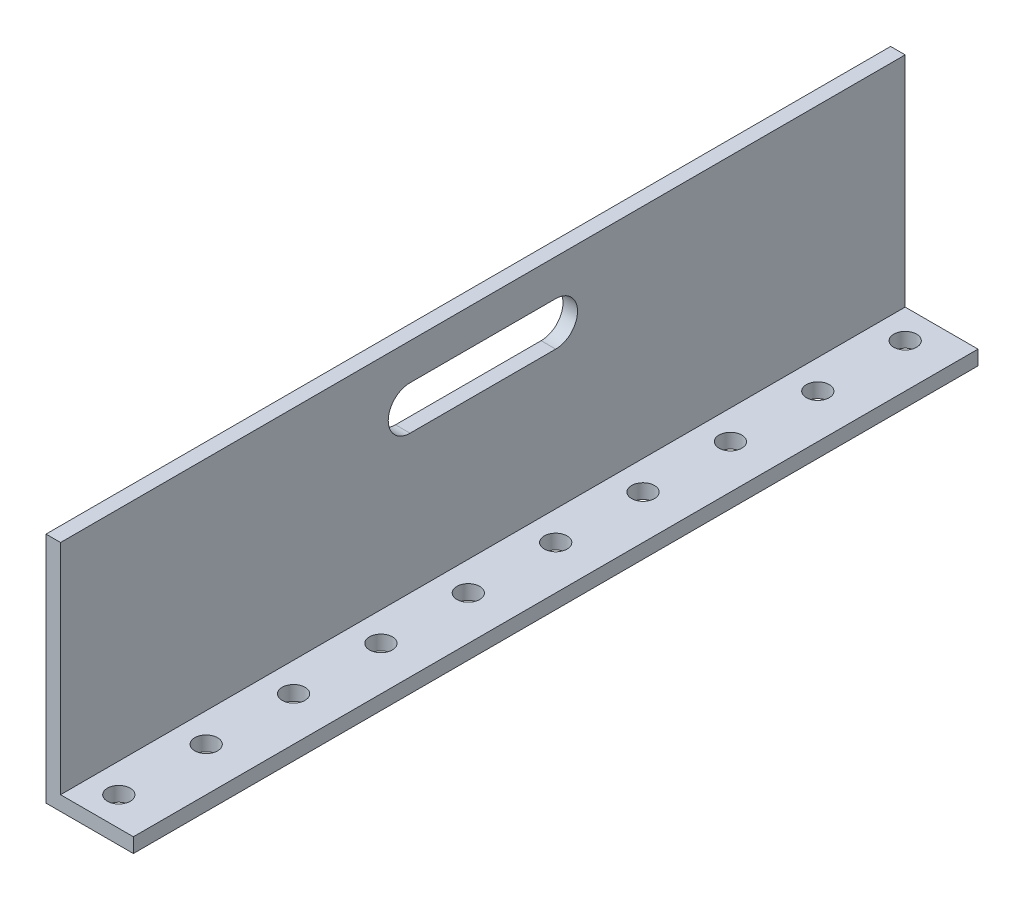
from build123d import *

# Parameters (mm, degrees)
SKETCH1_W           = 3.175
SKETCH1_H           = 47.625
SKETCH1_H_2         = 3.175
SKETCH1_W_2         = 15.875
BOSS_EXTRUDE1_DEPTH = 184.15
SKETCH2_R           = 2.4892
CUT_EXTRUDE1_DEPTH  = 184.15
CUT_EXTRUDE2_DEPTH  = 165.1


with BuildPart() as part:
    # Sketch1 → Boss-Extrude1 (new body)
    with BuildSketch(Plane.XY):
        with Locations((1.5875, 26.9875)):
            Rectangle(SKETCH1_W, SKETCH1_H)
        with Locations((1.5875, 1.5875)):
            Rectangle(SKETCH1_W, SKETCH1_H_2)
        with Locations((11.1125, 1.5875)):
            Rectangle(SKETCH1_W_2, SKETCH1_H_2)
    extrude(amount=BOSS_EXTRUDE1_DEPTH)

    # Sketch2 → Cut-Extrude1 (cut)
    with BuildSketch(Plane(origin=(0, 3.175, 0), x_dir=(1, 0, 0), z_dir=(0, 1, 0))):
        with Locations(Location((9.525, -6.35, 0), (0, 0, 270))):
            Circle(SKETCH2_R)
        with Locations(Location((9.525, -25.4, 0), (0, 0, 270))):
            Circle(SKETCH2_R)
        with Locations(Location((9.525, -44.45, 0), (0, 0, 270))):
            Circle(SKETCH2_R)
        with Locations(Location((9.525, -63.5, 0), (0, 0, 270))):
            Circle(SKETCH2_R)
        with Locations(Location((9.525, -82.55, 0), (0, 0, 270))):
            Circle(SKETCH2_R)
        with Locations(Location((9.525, -101.6, 0), (0, 0, 270))):
            Circle(SKETCH2_R)
        with Locations(Location((9.525, -120.65, 0), (0, 0, 270))):
            Circle(SKETCH2_R)
        with Locations(Location((9.525, -139.7, 0), (0, 0, 270))):
            Circle(SKETCH2_R)
        with Locations(Location((9.525, -158.75, 0), (0, 0, 270))):
            Circle(SKETCH2_R)
        with Locations(Location((9.525, -177.8, 0), (0, 0, 270))):
            Circle(SKETCH2_R)
    extrude(amount=-CUT_EXTRUDE1_DEPTH, mode=Mode.SUBTRACT)

    # Sketch3 → Cut-Extrude2 (cut)
    with BuildSketch(Plane.ZY):
        with BuildLine():
            Line((76.2, 42.8625), (107.95, 42.8625))
            ThreePointArc((107.95, 42.8625), (112.7125, 38.1), (107.95, 33.3375))
            Line((107.95, 33.3375), (76.2, 33.3375))
            ThreePointArc((76.2, 33.3375), (71.4375, 38.1), (76.2, 42.8625))
        make_face()
    extrude(amount=-CUT_EXTRUDE2_DEPTH, mode=Mode.SUBTRACT)


solid = part.part
